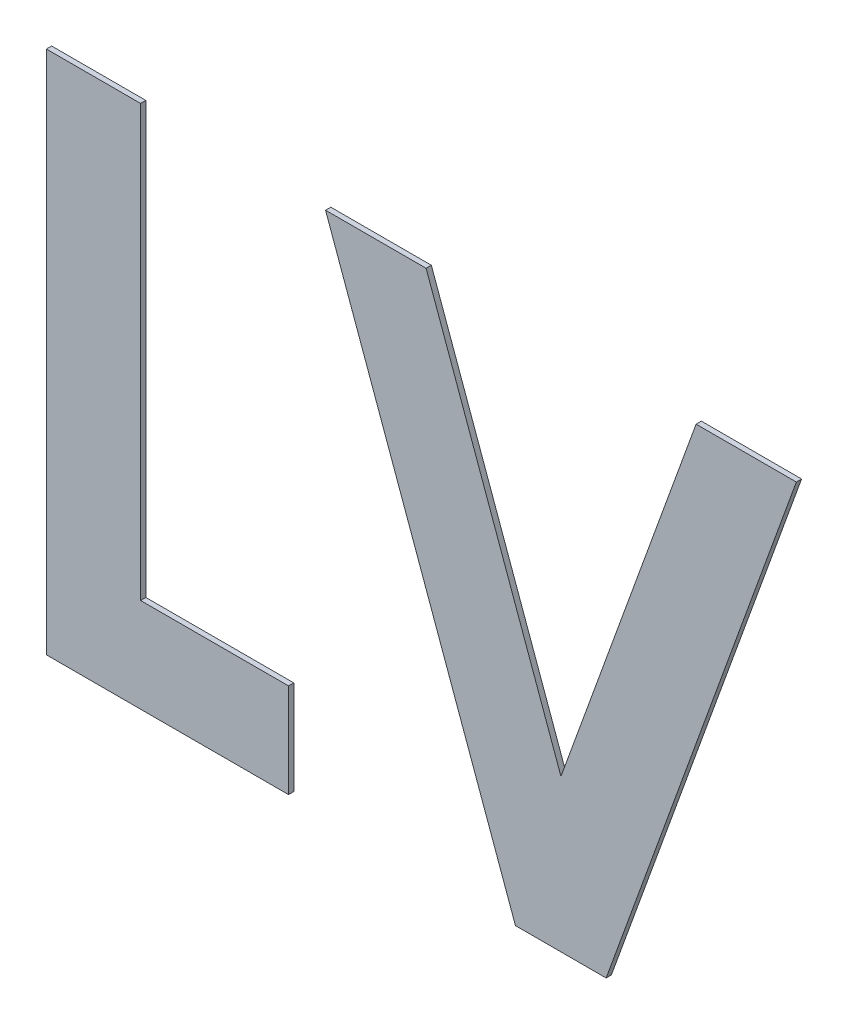
from build123d import *

# Parameters (mm, degrees)
BOSS_EXTRUDE1_DEPTH   = 0.1
BOSS_EXTRUDE1_2_DEPTH = 0.1


with BuildPart() as part:
    # Sketch1 → Boss-Extrude1 (new body)
    with BuildSketch(Plane.XY):
        Polygon((-6.794871795, 10), (-6.794871795, 0), (-2.179487179, 0), (-2.179487179, 1.794871795), (-5, 1.794871795), (-5, 10), align=None)
    extrude(amount=BOSS_EXTRUDE1_DEPTH)


with BuildPart() as body_2:
    # Sketch1 → Boss-Extrude1 2 (new body)
    with BuildSketch(Plane.XY):
        Polygon((-1.474358974, 10), (2.145432692, 0), (3.874198718, 0), (7.5, 10), (5.588942308, 10), (3.012820513, 2.896634615), (0.442708333, 10), align=None)
    extrude(amount=BOSS_EXTRUDE1_2_DEPTH)


solid = Compound([part.part, body_2.part])
